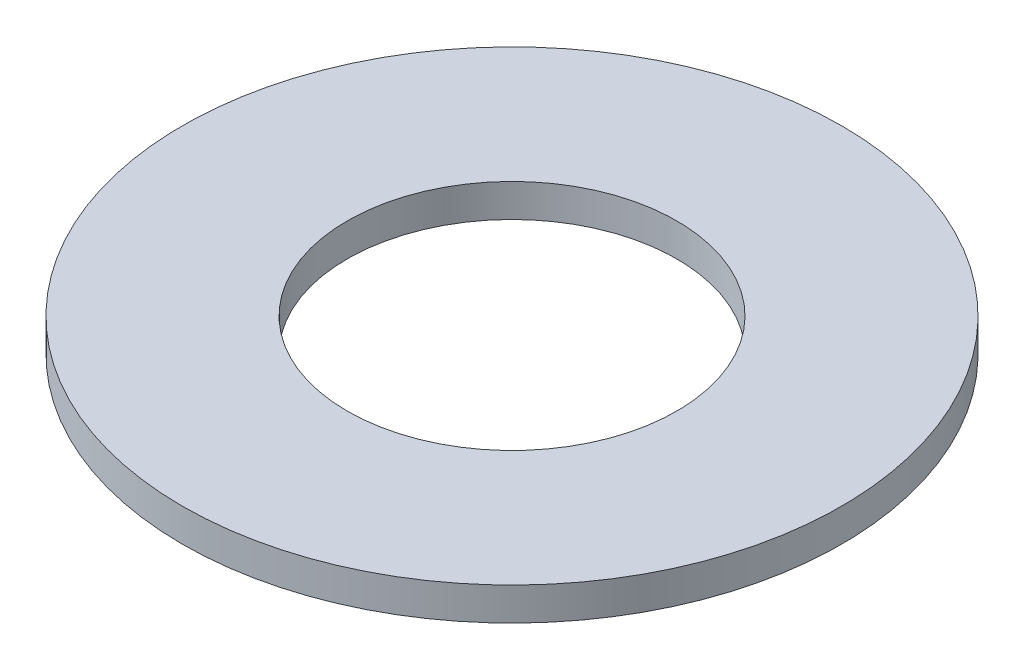
from build123d import *

# Parameters (mm, degrees)
SKETCH1_R           = 5
SKETCH1_R_2         = 2.5
BOSS_EXTRUDE1_DEPTH = 0.5


with BuildPart() as part:
    # Sketch1 → Boss-Extrude1 (new body)
    with BuildSketch(Plane(origin=(0, 0, 0), x_dir=(1, 0, 0), z_dir=(0, 1, 0))):
        with Locations(Location((0, 0, 0), (0, 0, 270))):
            Circle(SKETCH1_R)
        with Locations(Location((0, 0, 0), (0, 0, 270))):
            Circle(SKETCH1_R_2, mode=Mode.SUBTRACT)
    extrude(amount=BOSS_EXTRUDE1_DEPTH)


solid = part.part
